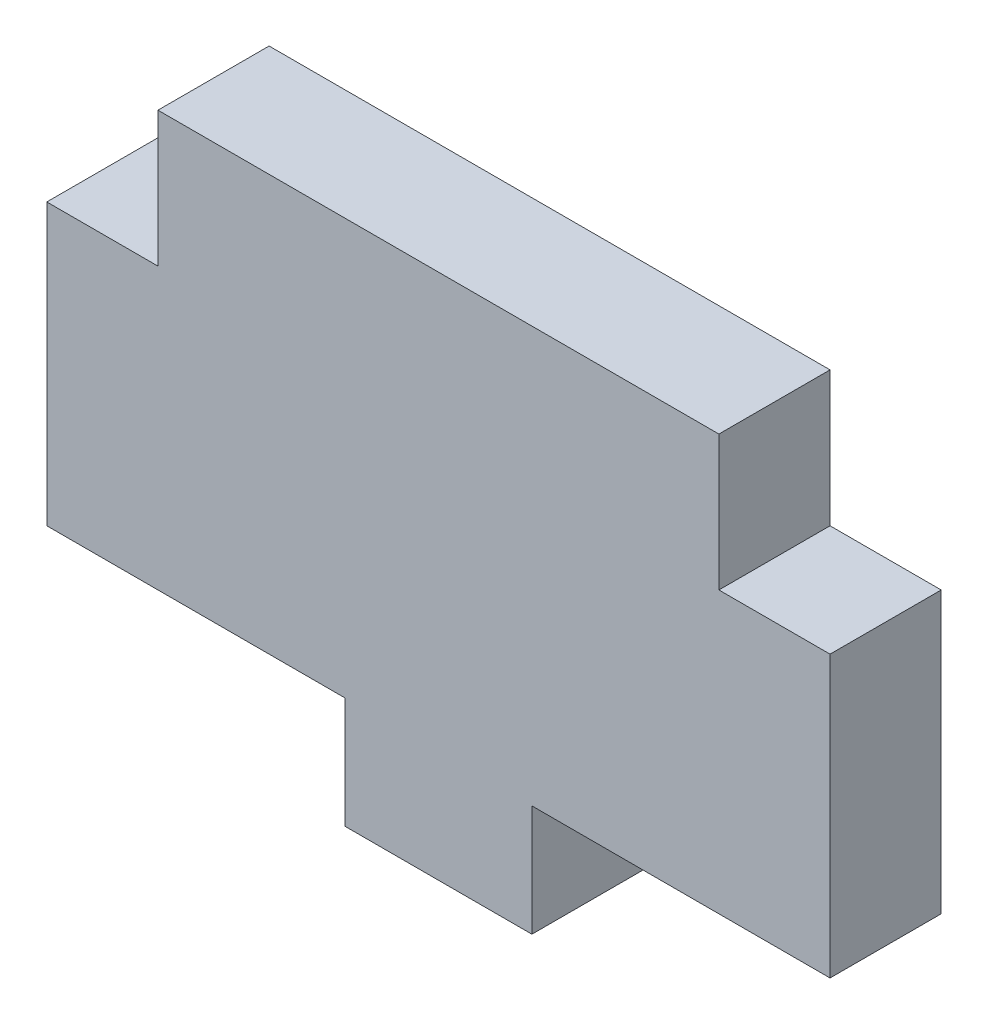
from build123d import *

# Parameters (mm, degrees)
BOSS_EXTRUDE1_DEPTH = 5.35


with BuildPart() as part:
    # Model → Boss-Extrude1 (new body)
    with BuildSketch(Plane.XY):
        Polygon((32.349998597, 25.349999778), (5.350000225, 25.349999778), (5.350000225, 18.850000575), (0, 18.850000575), (0, 5.350000225), (14.349999372, 5.350000225), (14.349999372, 0), (23.350000847, 0), (23.350000847, 5.350000225), (37.699999753, 5.350000225), (37.699999753, 18.850000575), (32.349998597, 18.850000575), align=None)
    extrude(amount=BOSS_EXTRUDE1_DEPTH)


solid = part.part
